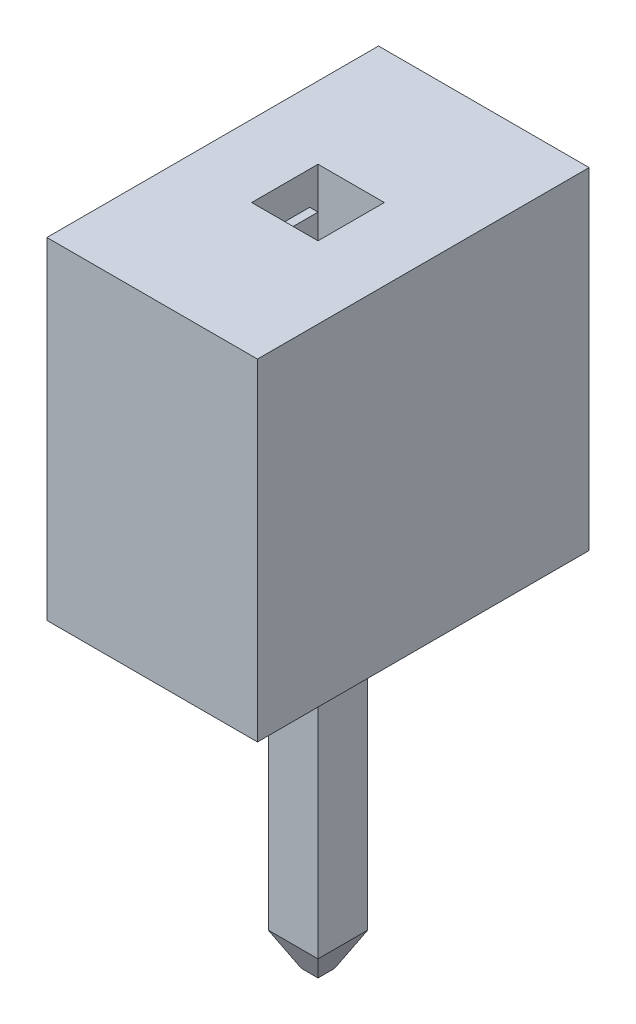
from build123d import *
from OCP.BRepFilletAPI import BRepFilletAPI_MakeChamfer

# Parameters (mm, degrees)
SKETCH_1_W        = 1.27
SKETCH_1_H        = 2
SKETCH_1_W_2      = 0.4
SKETCH_1_H_2      = 0.4
EXTRUDE_1_DEPTH   = 2
SKETCH_3_W        = 0.2
SKETCH_3_H        = 0.3
EXTRUDE_2_DEPTH   = 1.8
EXTRUDE_2_2_DEPTH = 1.8
SKETCH_5_W        = 1.27
SKETCH_5_H        = 0.3
EXTRUDE_3_DEPTH   = 0.1
SKETCH_6_W        = 0.3
SKETCH_6_H        = 0.3
EXTRUDE_4_DEPTH   = 2
CHAMFER_1_SIZE    = 0.2
CHAMFER_1_SIZE2   = 0.1


with BuildPart() as part:
    # 草图1 → 凸台-拉伸1 (new body)
    with BuildSketch(Plane(origin=(0, 0, 0), x_dir=(1, 0, 0), z_dir=(0, 1, 0))):
        Rectangle(SKETCH_1_W, SKETCH_1_H)
        Rectangle(SKETCH_1_W_2, SKETCH_1_H_2, mode=Mode.SUBTRACT)
    extrude(amount=EXTRUDE_1_DEPTH)



with BuildPart() as body_2:
    # 草图3 → 凸台-拉伸2 (new body)
    with BuildSketch(Plane(origin=(0, 1.8, 0), x_dir=(1, 0, 0), z_dir=(0, 1, 0))):
        with Locations((0.25, 0)):
            Rectangle(SKETCH_3_W, SKETCH_3_H)
    extrude(amount=-EXTRUDE_2_DEPTH)


with BuildPart() as body_3:
    # 草图3 → Extrude 2 2 (new body)
    with BuildSketch(Plane(origin=(0, 1.8, 0), x_dir=(1, 0, 0), z_dir=(0, 1, 0))):
        with Locations((-0.25, 0)):
            Rectangle(SKETCH_3_W, SKETCH_3_H)
    extrude(amount=-EXTRUDE_2_2_DEPTH)


with BuildPart() as part_1:
    add(part.part)

    add(body_2.part)  # 凸台-拉伸3 merges body 2

    add(body_3.part)  # 凸台-拉伸3 merges body 3
    # 草图5 → 凸台-拉伸3 (add)
    with BuildSketch(Plane.XZ):
        Rectangle(SKETCH_5_W, SKETCH_5_H)
    extrude(amount=-EXTRUDE_3_DEPTH)

    # 草图6 → 凸台-拉伸4 (add)
    with BuildSketch(Plane.XZ):
        Rectangle(SKETCH_6_W, SKETCH_6_H)
    extrude(amount=EXTRUDE_4_DEPTH)

    # 倒角1: one chamfer whose edges measure the first distance from different faces: ONE call of the kernel's chamfer builder (chamfer() names one face for all edges)
    chamfer_1_edges_1 = [part_1.edges().sort_by_distance(p)[0] for p in [
        (0, -2, 0.15),
    ]]
    chamfer_1_side_1 = [part_1.faces().sort_by_distance(p)[0] for p in [
        (0, -0.538888889, 0.15),
    ]]
    chamfer_1_edges_2 = [part_1.edges().sort_by_distance(p)[0] for p in [
        (0.15, -2, 0),
    ]]
    chamfer_1_side_2 = [part_1.faces().sort_by_distance(p)[0] for p in [
        (0.15, -1, 0),
    ]]
    chamfer_1_edges_3 = [part_1.edges().sort_by_distance(p)[0] for p in [
        (0, -2, -0.15),
    ]]
    chamfer_1_side_3 = [part_1.faces().sort_by_distance(p)[0] for p in [
        (0, -0.538888889, -0.15),
    ]]
    chamfer_1_edges_4 = [part_1.edges().sort_by_distance(p)[0] for p in [
        (-0.15, -2, 0),
    ]]
    chamfer_1_side_4 = [part_1.faces().sort_by_distance(p)[0] for p in [
        (-0.15, -1, 0),
    ]]
    chamfer_1 = BRepFilletAPI_MakeChamfer(part_1.part.solid().wrapped)
    for e in chamfer_1_edges_1:
        chamfer_1.Add(CHAMFER_1_SIZE, CHAMFER_1_SIZE2, e.wrapped, chamfer_1_side_1[0].wrapped)  # the first distance lies on this face
    for e in chamfer_1_edges_2:
        chamfer_1.Add(CHAMFER_1_SIZE, CHAMFER_1_SIZE2, e.wrapped, chamfer_1_side_2[0].wrapped)  # the first distance lies on this face
    for e in chamfer_1_edges_3:
        chamfer_1.Add(CHAMFER_1_SIZE, CHAMFER_1_SIZE2, e.wrapped, chamfer_1_side_3[0].wrapped)  # the first distance lies on this face
    for e in chamfer_1_edges_4:
        chamfer_1.Add(CHAMFER_1_SIZE, CHAMFER_1_SIZE2, e.wrapped, chamfer_1_side_4[0].wrapped)  # the first distance lies on this face
    add(Compound.cast(chamfer_1.Shape()), mode=Mode.REPLACE)


solid = part_1.part
